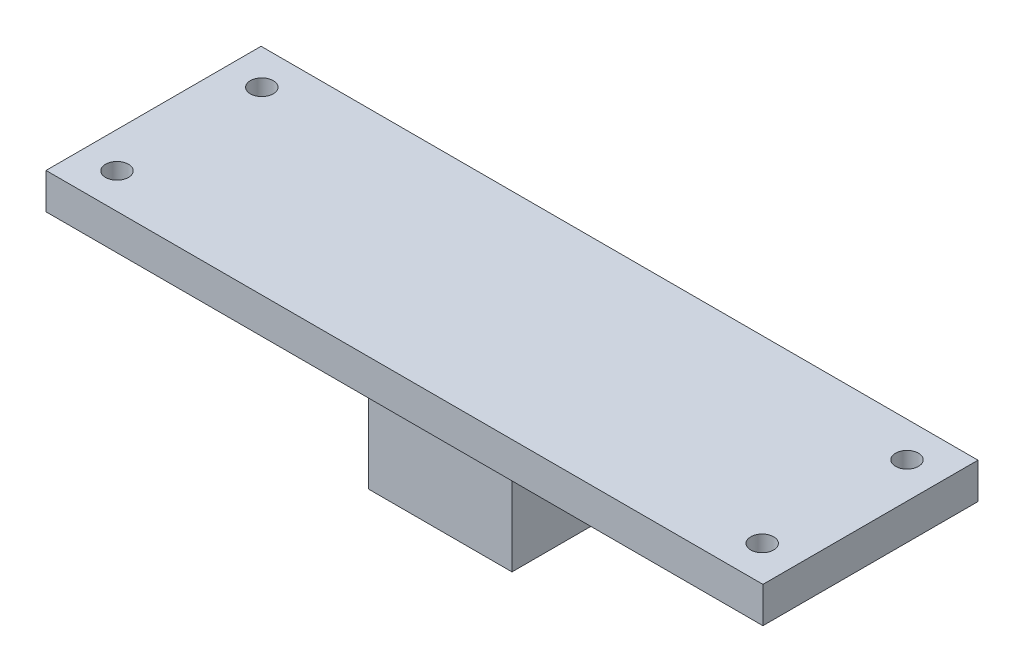
from build123d import *

# Parameters (mm, degrees)
SKETCH_1_W          = 100
SKETCH_1_H          = 30
EXTRUDE_1_DEPTH     = 5
SKETCH_2_R          = 1.6
CUT_EXTRUDE_1_DEPTH = 5
SKETCH_3_W          = 20
SKETCH_3_H          = 20
EXTRUDE_2_DEPTH     = 16
SKETCH_4_W          = 13
SKETCH_4_H          = 13
CUT_EXTRUDE_2_DEPTH = 16
SKETCH_5_R          = 2.5
CUT_EXTRUDE_3_DEPTH = 10


with BuildPart() as part:
    # Эскиз1 → Бобышка-Вытянуть1 (new body)
    with BuildSketch(Plane(origin=(0, 0, 0), x_dir=(1, 0, 0), z_dir=(0, 1, 0))):
        with Locations((10.328317373, 5.793433653)):
            Rectangle(SKETCH_1_W, SKETCH_1_H)
    extrude(amount=EXTRUDE_1_DEPTH)

    # Эскиз2 → Вырез-Вытянуть1 (cut)
    with BuildSketch(Plane(origin=(0, 5, 0), x_dir=(1, 0, 0), z_dir=(0, 1, 0))):
        with Locations(Location((-34.671682627, 15.893433653, 0), (0, 0, 270))):
            Circle(SKETCH_2_R)
        with Locations(Location((-34.671682627, -4.306566347, 0), (0, 0, 270))):
            Circle(SKETCH_2_R)
        with Locations(Location((55.328317373, 15.893433653, 0), (0, 0, 270))):
            Circle(SKETCH_2_R)
        with Locations(Location((55.328317373, -4.306566347, 0), (0, 0, 270))):
            Circle(SKETCH_2_R)
    extrude(amount=-CUT_EXTRUDE_1_DEPTH, mode=Mode.SUBTRACT)

    # Эскиз3 → Бобышка-Вытянуть2 (add)
    with BuildSketch(Plane.XZ):
        with Locations((10.328317373, -5.793433653)):
            Rectangle(SKETCH_3_W, SKETCH_3_H)
    extrude(amount=EXTRUDE_2_DEPTH)

    # Эскиз4 → Вырез-Вытянуть2 (cut)
    with BuildSketch(Plane.XZ.offset(16)):
        with Locations((10.328317373, -5.793433653)):
            Rectangle(SKETCH_4_W, SKETCH_4_H)
    extrude(amount=-CUT_EXTRUDE_2_DEPTH, mode=Mode.SUBTRACT)

    # Эскиз5 → Вырез-Вытянуть3 (cut)
    with BuildSketch(Plane(origin=(20.328317373, 0, 0), x_dir=(0, 0, -1), z_dir=(1, 0, 0))):
        with Locations((5.793433653, -7)):
            Circle(SKETCH_5_R)
    extrude(amount=-CUT_EXTRUDE_3_DEPTH, mode=Mode.SUBTRACT)


solid = part.part
